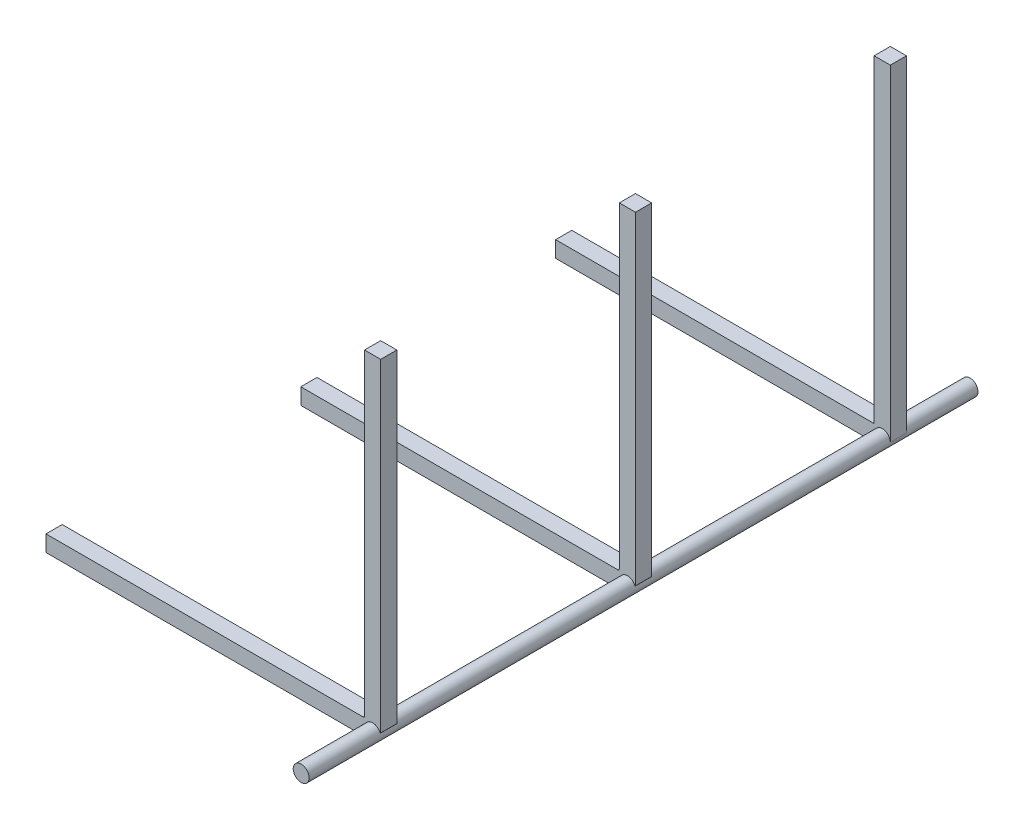
from build123d import *

# Parameters (mm, degrees)
SKETCH_1_R             = 25
EXTRUDE_1_DEPTH        = 2100
EXTRUDE_2_DEPTH        = 25.4
FILLET_8_R             = 1
FILLET_9_R             = 5
PATTERN_LINEAR_4_COUNT = 3
PATTERN_LINEAR_4_PITCH = 800
FILLET_10_R            = 1
FILLET_11_R            = 5


with BuildPart() as part:
    # 草图1 → 凸台-拉伸1 (new body)
    with BuildSketch(Plane.XY):
        Circle(SKETCH_1_R)
    extrude(amount=EXTRUDE_1_DEPTH)


with BuildPart() as body_2:
    # 草图2 → 凸台-拉伸2 (new, symmetric)
    with BuildSketch(Plane.XY.offset(1850)):
        with BuildLine():
            Line((24.999999999999982, 1.73e-15), (24.999999999999982, 1025.8))
            Line((24.999999999999982, 1025.8), (-25.80000000000002, 1025.8))
            Line((-25.80000000000002, 1025.8), (-25.799999999999898, 25.800000000000157))
            Line((-25.799999999999898, 25.800000000000157), (-1025.8, 25.79999999999627))
            Line((-1025.8, 25.79999999999627), (-1025.7999999999997, -25.000000000003688))
            Line((-1025.7999999999997, -25.000000000003688), (9.021e-14, -24.999999999999982))
            ThreePointArc((9.021e-14, -24.999999999999982), (-17.67766952966371, 17.67766952966364), (24.999999999999982, 1.73e-15))
        make_face()
    extrude_2 = extrude(amount=EXTRUDE_2_DEPTH, both=True)

    # 圆角8
    fillet_8_edges = [body_2.edges().sort_by_distance(p)[0] for p in [
        (9.021e-14, -24.999999999999982, 1850),
        (24.999999999999986, 2.86e-15, 1850),
    ]]
    fillet(fillet_8_edges, radius=FILLET_8_R)

    # 圆角9
    fillet_9_edges = [body_2.edges().sort_by_distance(p)[0] for p in [
        (-25.799999999999898, 25.800000000000157, 1850),
    ]]
    fillet(fillet_9_edges, radius=FILLET_9_R)


with BuildPart() as pattern_linear_4_1:
    # 阵列(线性)4: 凸台-拉伸2 ×3
    with Locations(*[(0, 0, -i * PATTERN_LINEAR_4_PITCH) for i in range(1, PATTERN_LINEAR_4_COUNT)]):
        add(extrude_2)

    # 圆角10
    fillet_10_edges = [pattern_linear_4_1.edges().sort_by_distance(p)[0] for p in [
        (9.021e-14, -24.999999999999982, 1050),
        (24.999999999999986, 2.86e-15, 1050),
    ]]
    fillet(fillet_10_edges, radius=FILLET_10_R)

    # 圆角11
    fillet_11_edges = [pattern_linear_4_1.edges().sort_by_distance(p)[0] for p in [
        (-25.799999999999898, 25.800000000000157, 1050),
    ]]
    fillet(fillet_11_edges, radius=FILLET_11_R)


solid = Compound([part.part, body_2.part, pattern_linear_4_1.part])
